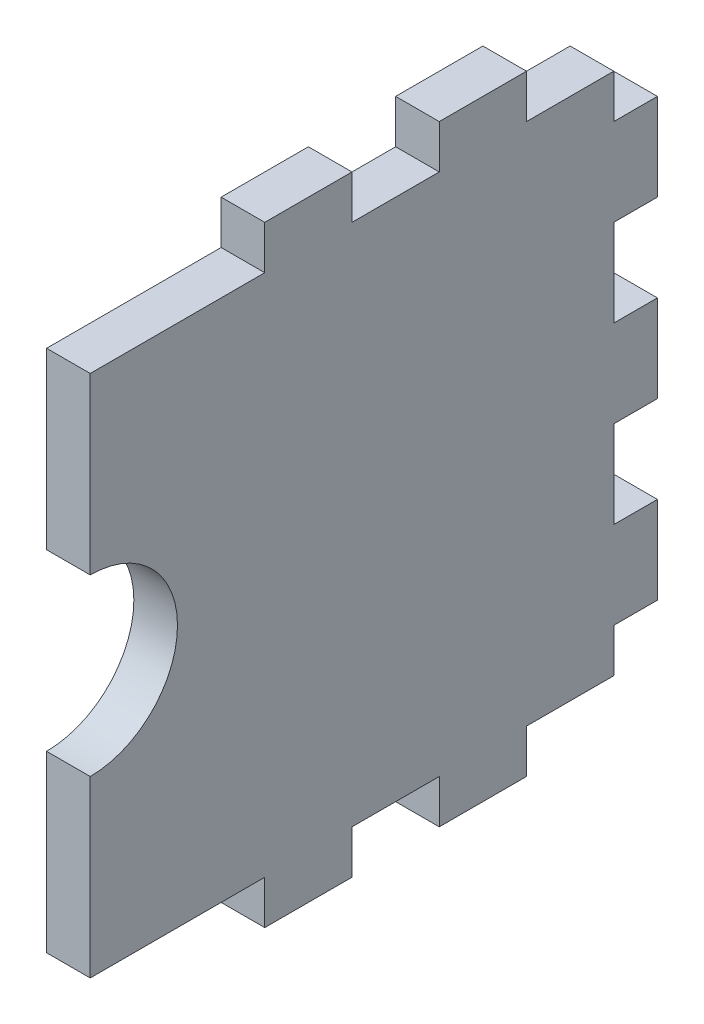
from build123d import *

# Parameters (mm, degrees)
SKETCH1_W           = 88.9
SKETCH1_H           = 82.55
BOSS_EXTRUDE1_DEPTH = 6.35
SKETCH2_R           = 12.7
SKETCH2_W           = 12.7
SKETCH2_H           = 6.35
SKETCH2_W_2         = 6.35
SKETCH2_H_2         = 25.4
SKETCH2_H_3         = 12.7
CUT_EXTRUDE2_DEPTH  = 6.35


with BuildPart() as part:
    # Sketch1 → Boss-Extrude1 (new body)
    with BuildSketch(Plane.YZ):
        with Locations((44.45, 41.275)):
            Rectangle(SKETCH1_W, SKETCH1_H)
    extrude(amount=BOSS_EXTRUDE1_DEPTH)

    # Sketch2 → Cut-Extrude2 (cut)
    with BuildSketch(Plane.YZ.offset(6.35)):
        with Locations((44.45, 82.55)):
            Circle(SKETCH2_R)
        with Locations((57.15, 3.175)):
            Rectangle(SKETCH2_W, SKETCH2_H)
        with Locations((31.75, 3.175)):
            Rectangle(SKETCH2_W, SKETCH2_H)
        Polygon((0, 0), (12.7, 0), (12.7, 6.35), (6.35, 6.35), (6.35, 19.05), (0, 19.05), (0, 6.35), align=None)
        Polygon((76.2, 0), (88.9, 0), (88.9, 6.35), (88.9, 19.05), (82.55, 19.05), (82.55, 6.35), (76.2, 6.35), align=None)
        with Locations((3.175, 69.85)):
            Rectangle(SKETCH2_W_2, SKETCH2_H_2)
        with Locations((3.175, 38.1)):
            Rectangle(SKETCH2_W_2, SKETCH2_H_3)
        with Locations((85.725, 38.1)):
            Rectangle(SKETCH2_W_2, SKETCH2_H_3)
        with Locations((85.725, 69.85)):
            Rectangle(SKETCH2_W_2, SKETCH2_H_2)
    extrude(amount=-CUT_EXTRUDE2_DEPTH, mode=Mode.SUBTRACT)


solid = part.part
